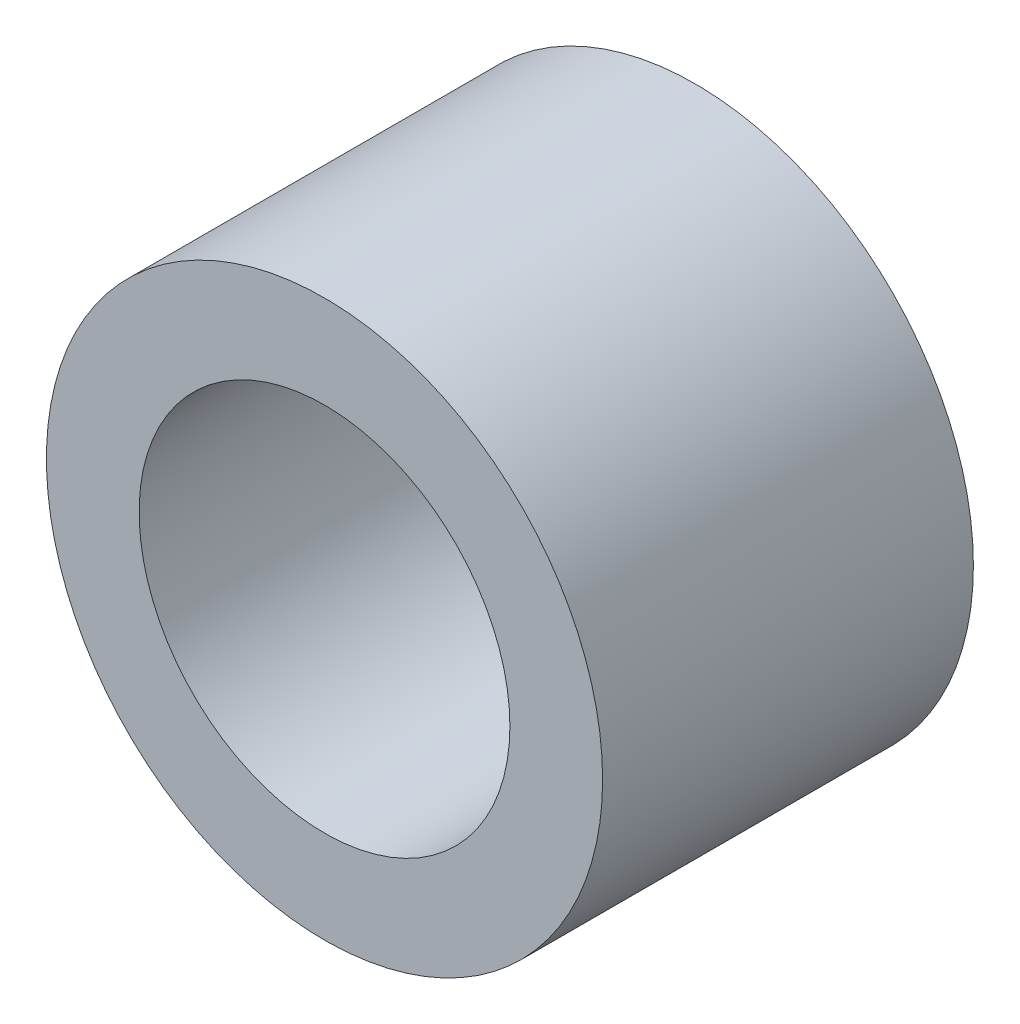
from build123d import *

# Parameters (mm, degrees)
SKETCH_1_R      = 7.5
SKETCH_1_R_2    = 5
EXTRUDE_1_DEPTH = 10


with BuildPart() as part:
    # Эскиз1 → Бобышка-Вытянуть1 (new body)
    with BuildSketch(Plane.XY):
        Circle(SKETCH_1_R)
        Circle(SKETCH_1_R_2, mode=Mode.SUBTRACT)
    extrude(amount=EXTRUDE_1_DEPTH)


solid = part.part
